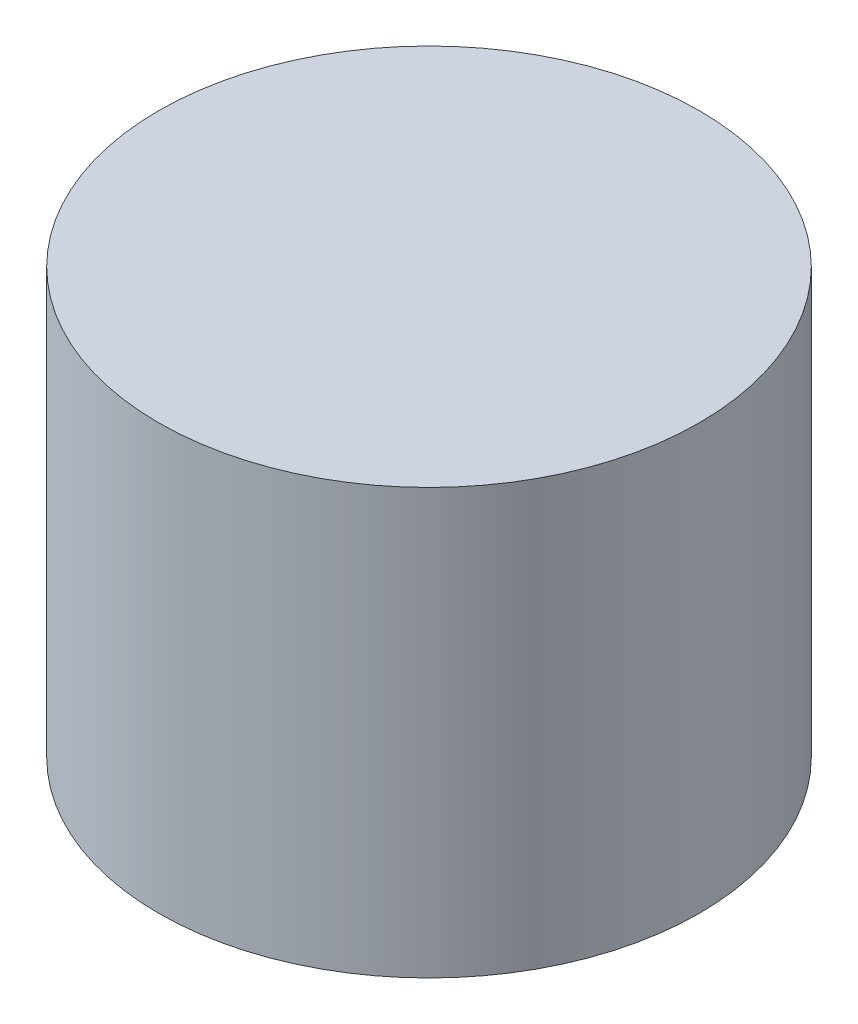
from build123d import *

# Parameters (mm, degrees)
SKETCH1_R           = 35
BOSS_EXTRUDE1_DEPTH = 55


with BuildPart() as part:
    # Sketch1 → Boss-Extrude1 (new body)
    with BuildSketch(Plane(origin=(0, 0, 0), x_dir=(1, 0, 0), z_dir=(0, 1, 0))):
        with Locations(Location((0, 0, 0), (0, 0, 270))):
            Circle(SKETCH1_R)
    extrude(amount=BOSS_EXTRUDE1_DEPTH)


solid = part.part
